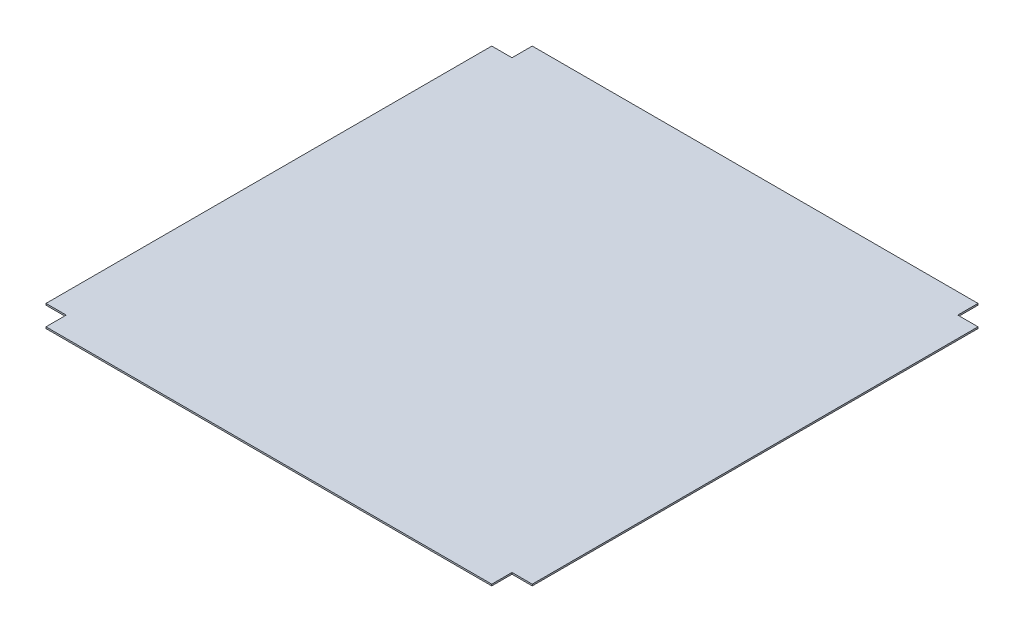
from build123d import *

# Parameters (mm, degrees)
SKETCH1_W           = 1219.2
SKETCH1_H           = 1219.2
BOSS_EXTRUDE1_DEPTH = 2
SKETCH2_W           = 50.8
SKETCH2_H           = 50.8
CUT_EXTRUDE1_DEPTH  = 863.113867189


with BuildPart() as part:
    # Sketch1 → Boss-Extrude1 (new, symmetric)
    with BuildSketch(Plane(origin=(0, 0, 0), x_dir=(1, 0, 0), z_dir=(0, 1, 0))):
        Rectangle(SKETCH1_W, SKETCH1_H)
    extrude(amount=BOSS_EXTRUDE1_DEPTH, both=True)

    # Sketch2 → Cut-Extrude1 (cut, through all)
    with BuildSketch(Plane(origin=(0, 2, 0), x_dir=(1, 0, 0), z_dir=(0, 1, 0))):
        with Locations((-584.2, 584.2)):
            Rectangle(SKETCH2_W, SKETCH2_H)
        with Locations((584.2, 584.2)):
            Rectangle(SKETCH2_W, SKETCH2_H)
        with Locations((584.2, -584.2)):
            Rectangle(SKETCH2_W, SKETCH2_H)
        with Locations((-584.2, -584.2)):
            Rectangle(SKETCH2_W, SKETCH2_H)
    extrude(amount=-CUT_EXTRUDE1_DEPTH, mode=Mode.SUBTRACT)


solid = part.part
